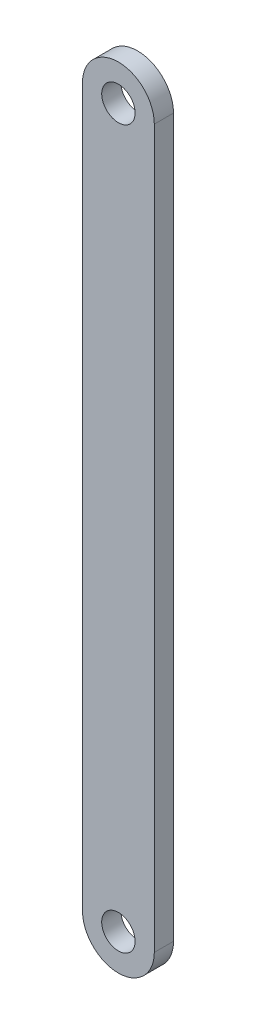
from build123d import *

# Parameters (mm, degrees)
SKETCH1_R           = 4.35
BOSS_EXTRUDE1_DEPTH = 5


with BuildPart() as part:
    # Sketch1 → Boss-Extrude1 (new body)
    with BuildSketch(Plane.XY):
        with BuildLine():
            Line((-9.35, 0), (-9.35, 186.85))
            ThreePointArc((-9.35, 186.85), (0, 196.2), (9.35, 186.85))
            Line((9.35, 186.85), (9.35, 0))
            ThreePointArc((9.35, 0), (0, -9.35), (-9.35, 0))
        make_face()
        Circle(SKETCH1_R, mode=Mode.SUBTRACT)
        with Locations((0, 186.85)):
            Circle(SKETCH1_R, mode=Mode.SUBTRACT)
    extrude(amount=BOSS_EXTRUDE1_DEPTH)


solid = part.part
